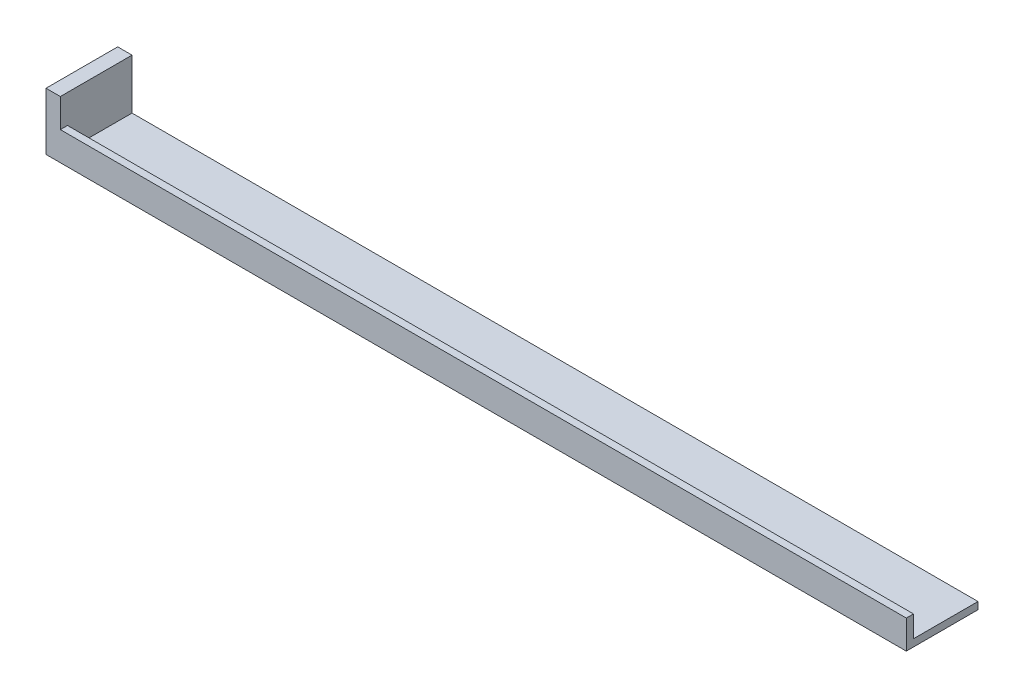
from build123d import *

# Parameters (mm, degrees)
Y_KSEKLIK_EKSTR_ZYON1_DEPTH = 10
IZIM2_W                     = 120
IZIM2_H                     = 1
Y_KSEKLIK_EKSTR_ZYON2_DEPTH = 3
IZIM4_W                     = 2
IZIM4_H                     = 10
Y_KSEKLIK_EKSTR_ZYON3_DEPTH = 4
KES_EKSTR_ZYON1_DEPTH       = 33


with BuildPart() as part:
    # Çizim1 → Yükseklik-Ekstrüzyon1 (new body)
    with BuildSketch(Plane.XY):
        Polygon((0, 0), (-120, 0), (-120, -1), (2, -1), (2, 3), (0, 3), align=None)
    y_kseklik_ekstr_zyon1 = extrude(amount=Y_KSEKLIK_EKSTR_ZYON1_DEPTH)

    # Çizim2 → Yükseklik-Ekstrüzyon2 (add)
    with BuildSketch(Plane(origin=(0, 0, 0), x_dir=(1, 0, 0), z_dir=(0, 1, 0))):
        with Locations((-60, -9.5)):
            Rectangle(IZIM2_W, IZIM2_H)
    y_kseklik_ekstr_zyon2 = extrude(amount=Y_KSEKLIK_EKSTR_ZYON2_DEPTH)

    # Çizim4 → Yükseklik-Ekstrüzyon3 (add)
    with BuildSketch(Plane(origin=(0, 3, 0), x_dir=(1, 0, 0), z_dir=(0, 1, 0))):
        with Locations((1, -5)):
            Rectangle(IZIM4_W, IZIM4_H)
    y_kseklik_ekstr_zyon3 = extrude(amount=Y_KSEKLIK_EKSTR_ZYON3_DEPTH)

    # Aynalama1: Yükseklik-Ekstrüzyon1, Yükseklik-Ekstrüzyon2, Yükseklik-Ekstrüzyon3 across plane
    add(y_kseklik_ekstr_zyon1.mirror(Plane(origin=(0, 0, 10), x_dir=(0, 0, 1), z_dir=(1, 0, 0))))
    add(y_kseklik_ekstr_zyon2.mirror(Plane(origin=(0, 0, 10), x_dir=(0, 0, 1), z_dir=(1, 0, 0))))
    add(y_kseklik_ekstr_zyon3.mirror(Plane(origin=(0, 0, 10), x_dir=(0, 0, 1), z_dir=(1, 0, 0))))

    # Çizim5 → Kes-Ekstrüzyon1 (cut)
    with BuildSketch(Plane(origin=(0, 0, 0), x_dir=(-1, 0, 0), z_dir=(0, 0, -1))):
        Polygon((0, 7), (0, -4.162998524), (124.646798912, -4.162998524), (124.646798912, 13.350515485), (0, 13.350515485), align=None)
    extrude(amount=-KES_EKSTR_ZYON1_DEPTH, mode=Mode.SUBTRACT)


solid = part.part
